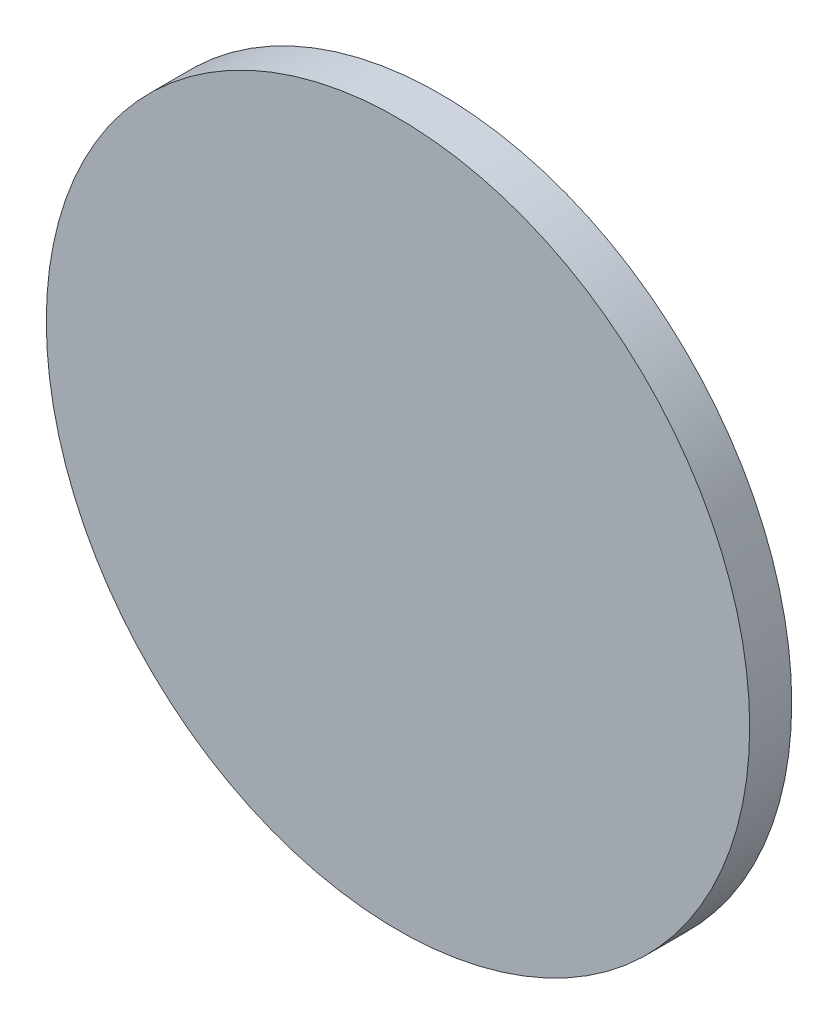
from build123d import *

# Parameters (mm, degrees)
SKETCH2_R           = 25.1
BOSS_EXTRUDE1_DEPTH = 3


with BuildPart() as part:
    # Sketch2 → Boss-Extrude1 (new body)
    with BuildSketch(Plane.XY):
        Circle(SKETCH2_R)
    extrude(amount=BOSS_EXTRUDE1_DEPTH)


solid = part.part
